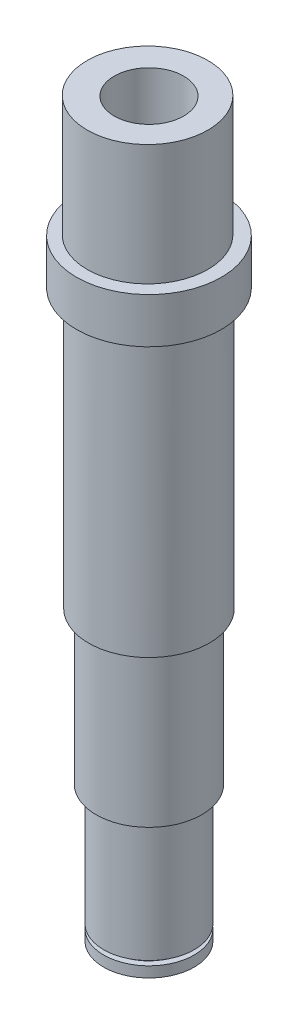
from build123d import *

# Parameters (mm, degrees)
SKETCH1_R               = 20
BOSS_EXTRUDE1_DEPTH     = 142.5
SKETCH2_R               = 24
BOSS_EXTRUDE2_DEPTH     = 15
SKETCH3_R               = 20
BOSS_EXTRUDE3_DEPTH     = 40
SKETCH5_R               = 15
BOSS_EXTRUDE4_DEPTH     = 45
CUT_EXTRUDE1_DEPTH      = 245.863737617
CUT_EXTRUDE1_DEPTH_BACK = 245.863737617
SKETCH4_R               = 11.5
SKETCH7_W               = 2
SKETCH7_H               = 1.5
SKETCH10_W              = 2.5
SKETCH10_H              = 50.5


with BuildPart() as part:
    # Sketch1 → Boss-Extrude1 (new body)
    with BuildSketch(Plane(origin=(0, 0, 0), x_dir=(1, 0, 0), z_dir=(0, 1, 0))):
        with Locations(Location((0, 0, 0), (0, 0, 270))):
            Circle(SKETCH1_R)
    extrude(amount=BOSS_EXTRUDE1_DEPTH)

    # Sketch2 → Boss-Extrude2 (add)
    with BuildSketch(Plane(origin=(0, 142.5, 0), x_dir=(1, 0, 0), z_dir=(0, 1, 0))):
        with Locations(Location((0, 0, 0), (0, 0, 270))):
            Circle(SKETCH2_R)
    extrude(amount=BOSS_EXTRUDE2_DEPTH)

    # Sketch3 → Boss-Extrude3 (add)
    with BuildSketch(Plane(origin=(0, 157.5, 0), x_dir=(1, 0, 0), z_dir=(0, 1, 0))):
        with Locations(Location((-0.463755605, 0, 0), (0, 0, 270))):
            Circle(SKETCH3_R)
    extrude(amount=BOSS_EXTRUDE3_DEPTH)

    # Sketch5 → Boss-Extrude4 (add)
    with BuildSketch(Plane.XZ):
        with Locations(Location((0, 0, 0), (0, 0, 90))):
            Circle(SKETCH5_R)
    extrude(amount=BOSS_EXTRUDE4_DEPTH)

    # Sketch4 → Cut-Extrude1 (cut, two sides: drawn at the far end of the back side and taken through both)
    with BuildSketch(Plane(origin=(0, 197.5, 0), x_dir=(1, 0, 0), z_dir=(0, 1, 0)).offset(-CUT_EXTRUDE1_DEPTH_BACK)):
        with Locations(Location((0, 0, 0), (0, 0, 270))):
            Circle(SKETCH4_R)
    extrude(amount=CUT_EXTRUDE1_DEPTH + CUT_EXTRUDE1_DEPTH_BACK, mode=Mode.SUBTRACT)

    # Sketch7 → Cut-Revolve1 (revolve, cut)
    with BuildSketch(Plane(origin=(0, 0, 0), x_dir=(0, 0, -1), z_dir=(1, 0, 0)), mode=Mode.PRIVATE) as cut_revolve1_sk:
        with Locations((14, -40.75)):
            Rectangle(SKETCH7_W, SKETCH7_H)
    revolve(cut_revolve1_sk.sketch.rotate(Axis((0, -40.130931017, 0), (0, 1, 0)), 180), axis=Axis((0, -40.130931017, 0), (0, 1, 0)), mode=Mode.SUBTRACT)

    # Sketch10 → Cut-Revolve2 (revolve, cut)
    with BuildSketch(Plane.XY, mode=Mode.PRIVATE) as cut_revolve2_sk:
        with Locations((-18.75, 25.25)):
            Rectangle(SKETCH10_W, SKETCH10_H)
    revolve(cut_revolve2_sk.sketch.rotate(Axis((0, -22.168396133, 0), (0, 1, 0)), 270), axis=Axis((0, -22.168396133, 0), (0, 1, 0)), mode=Mode.SUBTRACT)


solid = part.part
